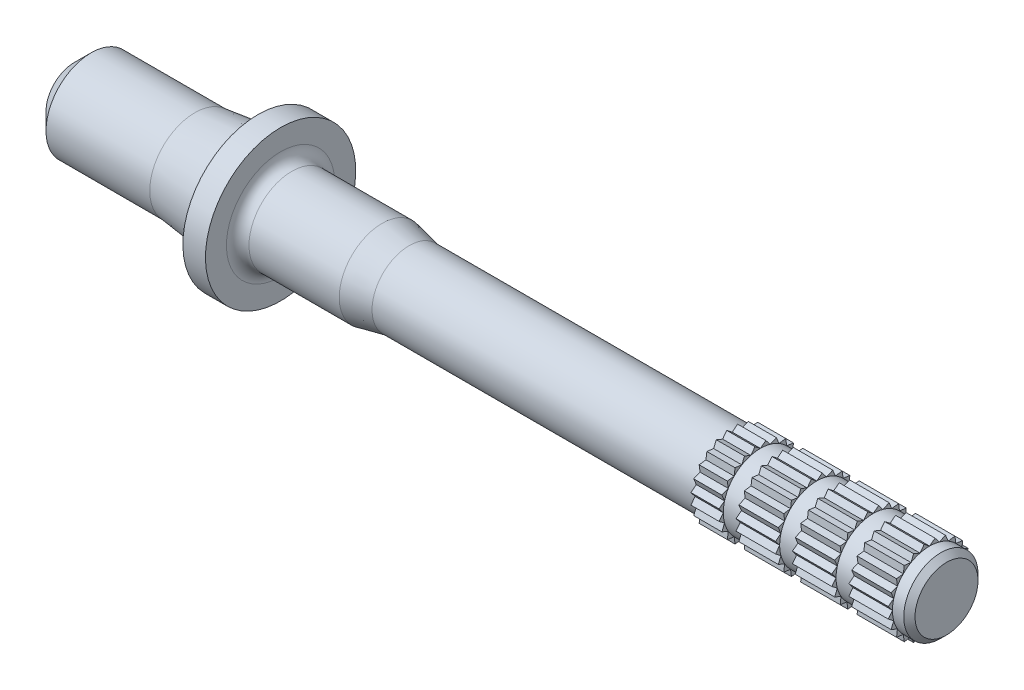
from build123d import *

# Parameters (mm, degrees)
CUT_EXTRUDE1_REACH = 40.956
CIRPATTERN1_COUNT  = 24
SKETCH3_OUTSIDE_W  = 16.622
SKETCH3_OUTSIDE_H  = 16.622
SKETCH3_OUTSIDE_R  = 1.646333965
CUT_EXTRUDE2_DEPTH = 0.75
LPATTERN1_COUNT    = 4
LPATTERN1_PITCH    = 2.5
CHAMFER1_SIZE      = 0.75
CHAMFER2_SIZE      = 0.25
FILLET1_R          = 0.5


with BuildPart() as part:
    # Sketch1 → Revolve1 (revolve)
    with BuildSketch(Plane.XY):
        Polygon((0, 0), (0, 2), (5.35, 2), (8.15, 2.331401839), (8.15, 3.331401839), (9.15, 3.331401839), (9.15, 1.901401839), (13.65, 1.901401839), (14.85, 1.646333965), (29.17, 1.646333965), (29.17, 1.85), (38.67, 1.85), (38.67, 0), align=None)
    revolve(axis=Axis((38.67, 0, 0), (-1, 0, 0)))

    # Sketch2 → Cut-Extrude1 (cut, up to next)
    with BuildSketch(Plane(origin=(38.67, 0, 0), x_dir=(0, 0, -1), z_dir=(1, 0, 0)), mode=Mode.PRIVATE) as cut_extrude1_sk1:
        with BuildLine():
            Line((-0.244307448, 1.833797664), (0, 1.646333965))
            Line((0, 1.646333965), (0.244307448, 1.833797664))
            ThreePointArc((0.244307448, 1.833797664), (0, 1.85), (-0.244307448, 1.833797664))
        make_face()
    cut_extrude1_tool1 = extrude(cut_extrude1_sk1.sketch, amount=-CUT_EXTRUDE1_REACH, mode=Mode.PRIVATE) & part.part
    cut_extrude1 = cut_extrude1_tool1.solids().sort_by_distance((38.67, 1.778442, 0))[0]
    add(cut_extrude1, mode=Mode.SUBTRACT)

    # CirPattern1: Cut-Extrude1 ×24 about axis
    cirpattern1_axis = Axis((0, 0, 0), (1, 0, 0))
    for i in range(1, CIRPATTERN1_COUNT):
        add(cut_extrude1.rotate(cirpattern1_axis, i * 360 / CIRPATTERN1_COUNT), mode=Mode.SUBTRACT)

    # Sketch3 outside → Cut-Extrude2 (cut)
    with BuildSketch(Plane(origin=(38.67, 0, 0), x_dir=(0, 0, -1), z_dir=(1, 0, 0))):
        Rectangle(SKETCH3_OUTSIDE_W, SKETCH3_OUTSIDE_H)
        with Locations(Location((0, 0, 0), (0, 0, 90))):
            Circle(SKETCH3_OUTSIDE_R, mode=Mode.SUBTRACT)
    cut_extrude2 = extrude(amount=-CUT_EXTRUDE2_DEPTH, mode=Mode.SUBTRACT)

    # LPattern1: Cut-Extrude2 ×4
    with Locations(*[(-i * LPATTERN1_PITCH, 0, 0) for i in range(1, LPATTERN1_COUNT)]):
        add(cut_extrude2, mode=Mode.SUBTRACT)

    # Chamfer1
    chamfer1_edges = [part.edges().sort_by_distance(p)[0] for p in [
        (0, -2, 0),
    ]]
    chamfer(chamfer1_edges, length=CHAMFER1_SIZE)

    # Chamfer2
    chamfer2_edges = [part.edges().sort_by_distance(p)[0] for p in [
        (38.67, -1.646333965, 0),
    ]]
    chamfer(chamfer2_edges, length=CHAMFER2_SIZE)

    # Fillet1
    fillet1_edges = [part.edges().sort_by_distance(p)[0] for p in [
        (9.15, -1.901401839, 0),
        (8.15, -2.331401839, 0),
    ]]
    fillet(fillet1_edges, radius=FILLET1_R)


solid = part.part
